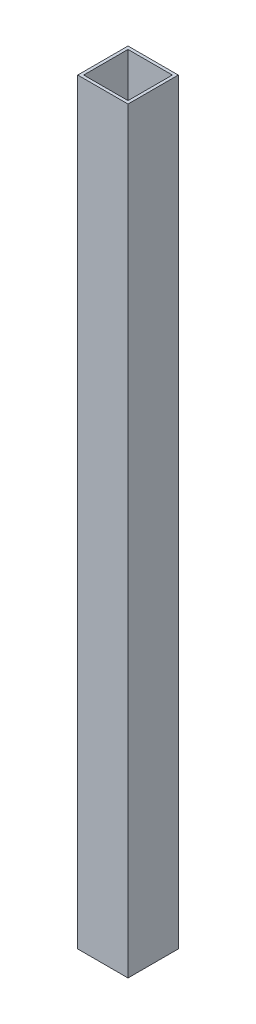
from build123d import *

# Parameters (mm, degrees)
SKETCH1_W           = 17
SKETCH1_H           = 17
SKETCH1_W_2         = 15
SKETCH1_H_2         = 15
BOSS_EXTRUDE1_DEPTH = 256


with BuildPart() as part:
    # Sketch1 → Boss-Extrude1 (new body)
    with BuildSketch(Plane(origin=(0, 0, 0), x_dir=(1, 0, 0), z_dir=(0, 1, 0))):
        Rectangle(SKETCH1_W, SKETCH1_H)
        Rectangle(SKETCH1_W_2, SKETCH1_H_2, mode=Mode.SUBTRACT)
    extrude(amount=BOSS_EXTRUDE1_DEPTH)


solid = part.part
